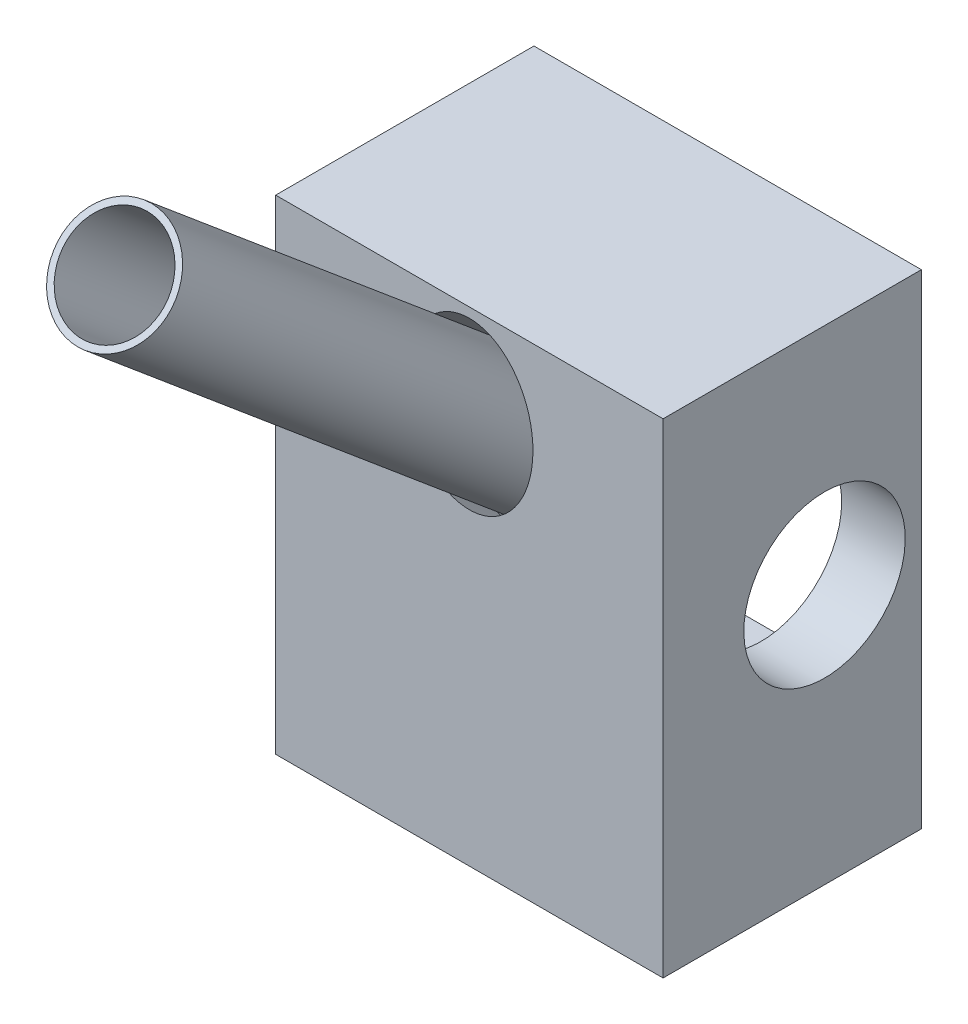
from build123d import *

# Parameters (mm, degrees)
BOSS_EXTRUDE1_START                            = 7.5
SKETCH1_W                                      = 30.48
SKETCH1_H                                      = 38.1
BOSS_EXTRUDE1_DEPTH                            = 20.32
SKETCH2_W                                      = 20.4
SKETCH2_H                                      = 22.86
CUT_EXTRUDE1_DEPTH                             = 16.51
SKETCH5_R                                      = 5
CUT_EXTRUDE2_DEPTH                             = 23
BOSS_EXTRUDE2_DEPTH                            = 21.59
BOSS_EXTRUDE2_DEPTH_BACK                       = 31.75
SKETCH10_R                                     = 4.5
SKETCH11_R                                     = 4
CUT_EXTRUDE6_DEPTH                             = 7540.718926849
CSK_FOR_M3_FLAT_HEAD_MACHINE_SCREW1_AT_2_COUNT = 2
CSK_FOR_M3_FLAT_HEAD_MACHINE_SCREW1_AT_2_PITCH = 22.86
CSK_FOR_M3_FLAT_HEAD_MACHINE_SCREW1_AT_3_COUNT = 2
CSK_FOR_M3_FLAT_HEAD_MACHINE_SCREW1_AT_3_PITCH = 38.1
CSK_FOR_M3_FLAT_HEAD_MACHINE_SCREW1_AT_4_COUNT = 2
CSK_FOR_M3_FLAT_HEAD_MACHINE_SCREW1_AT_4_PITCH = 30.48
SKETCH17_R                                     = 6.35
CUT_EXTRUDE7_DEPTH                             = 5742.70602656
SKETCH19_R                                     = 0.05
BOSS_EXTRUDE3_DEPTH                            = 0.1
SKETCH29_R                                     = 6
CUT_EXTRUDE8_DEPTH                             = 7.62
SKETCH30_W                                     = 3.81
SKETCH30_H                                     = 2.286
BOSS_EXTRUDE4_DEPTH                            = 2.54


with BuildPart() as part:
    # Sketch1 → Boss-Extrude1 (new body)
    with BuildSketch(Plane.XY.offset(BOSS_EXTRUDE1_START)):
        with Locations((6081.534193548, -5722.275806452)):
            Rectangle(SKETCH1_W, SKETCH1_H)
    extrude(amount=BOSS_EXTRUDE1_DEPTH)

    # Sketch2 → Cut-Extrude1 (cut)
    with BuildSketch(Plane(origin=(0, 0, 7.5), x_dir=(-1, 0, 0), z_dir=(0, 0, -1))):
        with Locations((-6081.574193548, -5722.275806452)):
            Rectangle(SKETCH2_W, SKETCH2_H)
    extrude(amount=-CUT_EXTRUDE1_DEPTH, mode=Mode.SUBTRACT)

    # Sketch5 → Cut-Extrude2 (cut)
    with BuildSketch(Plane(origin=(0, -2342.736843325, -2791.965049535), x_dir=(-1, 0, 0), z_dir=(0, -0.6427876096865405, -0.766044443118977))):
        with Locations(Location((-6081.534193548, -4392.394788186, 0), (0, 0, 26.10084585))):
            Circle(SKETCH5_R)
    extrude(amount=CUT_EXTRUDE2_DEPTH, mode=Mode.SUBTRACT)

    # Sketch14 → CSK for M3 Flat Head Machine Screw1 (revolve, cut)
    with BuildSketch(Plane(origin=(6092.964193548, -5707.035806452, 7.5), x_dir=(0, 1, 0), z_dir=(1, 0, 0))):
        Polygon((0, 0), (0, 9.906), (1.7, 8.884536948), (1.7, 1.45), (3.15, 0), align=None)
    csk_for_m3_flat_head_machine_screw1 = revolve(axis=Axis((6092.964193548, -5707.035806452, 1.15), (0, 0, 1)), mode=Mode.SUBTRACT)

    # CSK for M3 Flat Head Machine Screw1 at 2: CSK for M3 Flat Head Machine Screw1 ×2
    with Locations(*[(-i * CSK_FOR_M3_FLAT_HEAD_MACHINE_SCREW1_AT_2_PITCH, 0, 0) for i in range(1, CSK_FOR_M3_FLAT_HEAD_MACHINE_SCREW1_AT_2_COUNT)]):
        add(csk_for_m3_flat_head_machine_screw1, mode=Mode.SUBTRACT)

    # CSK for M3 Flat Head Machine Screw1 at 3: CSK for M3 Flat Head Machine Screw1 ×2
    with Locations(*[Vector(-0.5999999999999771, -0.8000000000000171, 0) * (i * CSK_FOR_M3_FLAT_HEAD_MACHINE_SCREW1_AT_3_PITCH) for i in range(1, CSK_FOR_M3_FLAT_HEAD_MACHINE_SCREW1_AT_3_COUNT)]):
        add(csk_for_m3_flat_head_machine_screw1, mode=Mode.SUBTRACT)

    # CSK for M3 Flat Head Machine Screw1 at 4: CSK for M3 Flat Head Machine Screw1 ×2
    with Locations(*[(0, -i * CSK_FOR_M3_FLAT_HEAD_MACHINE_SCREW1_AT_4_PITCH, 0) for i in range(1, CSK_FOR_M3_FLAT_HEAD_MACHINE_SCREW1_AT_4_COUNT)]):
        add(csk_for_m3_flat_head_machine_screw1, mode=Mode.SUBTRACT)


with BuildPart() as body_2:
    # Sketch10 → Boss-Extrude2 (new, two sides: drawn at the far end of the back side and taken through both)
    with BuildSketch(Plane(origin=(0, -2342.736843325, -2791.965049535), x_dir=(-1, 0, 0), z_dir=(0, -0.6427876096865405, -0.766044443118977)).offset(-BOSS_EXTRUDE2_DEPTH_BACK)):
        with Locations(Location((-6081.534193548, -4392.394788186, 0), (0, 0, 90))):
            Circle(SKETCH10_R)
    extrude(amount=BOSS_EXTRUDE2_DEPTH + BOSS_EXTRUDE2_DEPTH_BACK)

    # Sketch11 → Cut-Extrude6 (cut, through all)
    with BuildSketch(Plane(origin=(0, -2356.614627818, -2808.503949062), x_dir=(1, 0, 0), z_dir=(0, -0.6427876096865406, -0.766044443118977))):
        with Locations(Location((6081.534193548, 4392.394788186, 0), (0, 0, 270))):
            Circle(SKETCH11_R)
    extrude(amount=-CUT_EXTRUDE6_DEPTH, mode=Mode.SUBTRACT)


with BuildPart() as cut_extrude7_tool:
    # Sketch17 → Cut-Extrude7 (new, through all)
    with BuildSketch(Plane(origin=(6096.774193549, 0, 0), x_dir=(0, 0, -1), z_dir=(1, 0, 0))):
        with Locations(Location((-15.12, -5720.899791669, 0), (0, 0, 90))):
            Circle(SKETCH17_R)
    extrude(amount=-CUT_EXTRUDE7_DEPTH)


with BuildPart() as part_1:
    add(part.part)

    # Cut-Extrude7: cut by cut_extrude7_tool
    add(cut_extrude7_tool.part, mode=Mode.SUBTRACT)

    # Sketch19 → Boss-Extrude3 (add)
    with BuildSketch(Plane.XZ.offset(5741.325806452)):
        with Locations(Location((6081.534193548, 17.66, 0), (0, 0, 89.999999995))):
            Circle(SKETCH19_R)
    extrude(amount=BOSS_EXTRUDE3_DEPTH)

    # Sketch29 → Cut-Extrude8 (cut)
    with BuildSketch(Plane.XZ.offset(5741.325806452)):
        with Locations(Location((6081.534193548, 17.66, 0), (0, 0, 270))):
            Circle(SKETCH29_R)
    extrude(amount=-CUT_EXTRUDE8_DEPTH, mode=Mode.SUBTRACT)


with BuildPart() as body_2_1:
    add(body_2.part)

    # Cut-Extrude7: cut by cut_extrude7_tool
    add(cut_extrude7_tool.part, mode=Mode.SUBTRACT)


with BuildPart() as cut_extrude8_piece_1:
    # of the separate pieces the step leaves, piece 1, a body of its own (cut_extrude8_pieces)
    add(part_1.part.solids().sort_by_distance((6066.294193548, -5703.225806452, 7.5))[0])

    # Sketch30 → Boss-Extrude4 (add)
    with BuildSketch(Plane.XZ.offset(5741.325806452)):
        with Locations((6090.424193548, 24.01)):
            Rectangle(SKETCH30_W, SKETCH30_H)
        with Locations((6072.644193548, 11.31)):
            Rectangle(SKETCH30_W, SKETCH30_H)
    extrude(amount=BOSS_EXTRUDE4_DEPTH)


with BuildPart() as cut_extrude8_piece_2:
    # of the separate pieces the step leaves, piece 2, a body of its own (cut_extrude8_pieces)
    add(part_1.part.solids().sort_by_distance((6081.534193548, -5741.325806452, 17.71))[0])


solid = Compound([body_2_1.part, cut_extrude8_piece_1.part, cut_extrude8_piece_2.part])
